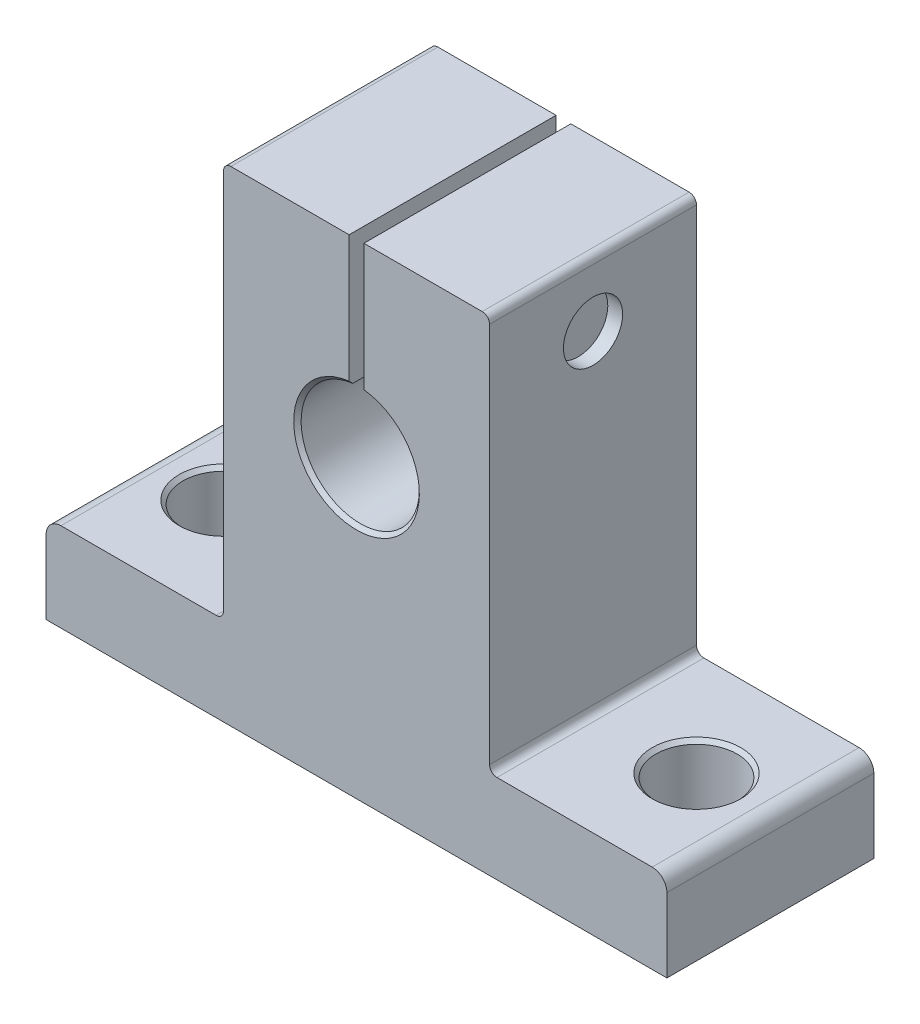
from build123d import *

# Parameters (mm, degrees)
BOSS_EXTRUDE1_DEPTH     = 14
CUT_EXTRUDE1_DEPTH      = 42.386471219
CUT_EXTRUDE1_DEPTH_BACK = 6
SKETCH3_R               = 2.75
FILLET1_R               = 1
FILLET2_R               = 0.5
CHAMFER1_SIZE           = 0.25
SKETCH4_R               = 3.1
CUT_EXTRUDE2_DEPTH      = 1
SKETCH5_R               = 3.1
SKETCH5_R_2             = 3
CUT_EXTRUDE3_DEPTH      = 4
CHAMFER2_SIZE           = 0.2
CUT_EXTRUDE4_DEPTH      = 2
SKETCH7_R               = 2
BOSS_EXTRUDE2_DEPTH     = 1
CUT_EXTRUDE5_START      = -1
SKETCH8_R               = 2
CUT_EXTRUDE5_DEPTH      = 1
SKETCH9_R               = 1.732050808
CUT_EXTRUDE6_DEPTH      = 1
CUT_EXTRUDE6_DRAFT      = -45


with BuildPart() as part:
    # Sketch1 → Boss-Extrude1 (new body)
    with BuildSketch(Plane.XY):
        with BuildLine():
            Line((-21, 0), (21, 0))
            Line((21, 0), (21, 6))
            Line((21, 6), (9, 6))
            Line((9, 6), (9, 32.8))
            Line((9, 32.8), (0.5, 32.8))
            Line((0.5, 32.8), (0.5, 23.968626967))
            ThreePointArc((0.5, 23.968626967), (0, 16), (-0.5, 23.968626967))
            Line((-0.5, 23.968626967), (-0.5, 32.8))
            Line((-0.5, 32.8), (-9, 32.8))
            Line((-9, 32.8), (-9, 6))
            Line((-9, 6), (-21, 6))
            Line((-21, 6), (-21, 0))
        make_face()
    extrude(amount=BOSS_EXTRUDE1_DEPTH)

    # Sketch3 → Cut-Extrude1 (cut, two sides: drawn at the far end of the back side and taken through both)
    with BuildSketch(Plane.XZ.offset(-CUT_EXTRUDE1_DEPTH_BACK)):
        with Locations(Location((-16, 7, 0), (0, 0, 180))):
            Circle(SKETCH3_R)
        with Locations(Location((16, 7, 0), (0, 0, 180))):
            Circle(SKETCH3_R)
    extrude(amount=CUT_EXTRUDE1_DEPTH + CUT_EXTRUDE1_DEPTH_BACK, mode=Mode.SUBTRACT)

    # Fillet1
    fillet1_edges = [part.edges().sort_by_distance(p)[0] for p in [
        (-21, 6, 7),
        (21, 6, 7),
    ]]
    fillet(fillet1_edges, radius=FILLET1_R)

    # Fillet2
    fillet2_edges = [part.edges().sort_by_distance(p)[0] for p in [
        (-9, 6, 7),
        (-9, 32.8, 7),
        (9, 32.8, 7),
        (9, 6, 7),
    ]]
    fillet(fillet2_edges, radius=FILLET2_R)

    # Chamfer1
    chamfer1_edges = [part.edges().sort_by_distance(p)[0] for p in [
        (0, 16, 0),
        (0, 16, 14),
        (18.75, 6, 7),
        (18.75, 0, 7),
        (-13.25, 6, 7),
        (-13.25, 0, 7),
    ]]
    chamfer(chamfer1_edges, length=CHAMFER1_SIZE)

    # Sketch4 → Cut-Extrude2 (cut)
    with BuildSketch(Plane.ZY.offset(9)):
        with Locations(Location((7, 28.4, 0), (0, 0, 270))):
            Circle(SKETCH4_R)
    extrude(amount=-CUT_EXTRUDE2_DEPTH, mode=Mode.SUBTRACT)

    # Sketch5 → Cut-Extrude3 (cut)
    with BuildSketch(Plane.ZY.offset(8)):
        with Locations(Location((7, 28.4, 0), (0, 0, 270))):
            Circle(SKETCH5_R)
        with Locations(Location((7, 28.4, 0), (0, 0, 270))):
            Circle(SKETCH5_R_2, mode=Mode.SUBTRACT)
    extrude(amount=-CUT_EXTRUDE3_DEPTH, mode=Mode.SUBTRACT)

    # Chamfer2
    chamfer2_edges = [part.edges().sort_by_distance(p)[0] for p in [
        (-8, 31.4, 7),
    ]]
    chamfer(chamfer2_edges, length=CHAMFER2_SIZE)

    # Sketch6 → Cut-Extrude4 (cut)
    with BuildSketch(Plane.ZY.offset(8)):
        Polygon((7.16076668, 30.124573592), (5.586858798, 29.401514825), (5.426092119, 27.676941233), (6.83923332, 26.675426408), (8.413141202, 27.398485175), (8.573907881, 29.123058767), align=None)
    extrude(amount=-CUT_EXTRUDE4_DEPTH, mode=Mode.SUBTRACT)

    # Sketch7 → Boss-Extrude2 (add)
    with BuildSketch(Plane(origin=(-0.5, 0, 0), x_dir=(0, 0, -1), z_dir=(1, 0, 0))):
        with Locations(Location((-7, 28.4, 0), (0, 0, 270))):
            Circle(SKETCH7_R)
    extrude(amount=BOSS_EXTRUDE2_DEPTH)

    # Sketch8 → Cut-Extrude5 (cut)
    with BuildSketch(Plane(origin=(9, 0, 0), x_dir=(0, 0, -1), z_dir=(1, 0, 0)).offset(CUT_EXTRUDE5_START)):
        with Locations(Location((-7, 28.4, 0), (0, 0, 270))):
            Circle(SKETCH8_R)
    extrude(amount=CUT_EXTRUDE5_DEPTH, mode=Mode.SUBTRACT)


with BuildPart() as cut_extrude6_tool:
    # Sketch9 → Cut-Extrude6 (with draft: the straight prism first)
    with BuildSketch(Plane.ZY.offset(8)):
        with Locations((7, 28.4)):
            Circle(SKETCH9_R)
    extrude(amount=-CUT_EXTRUDE6_DEPTH)
    # Cut-Extrude6: the draft: its side faces are tilted about the plane it starts from
    cut_extrude6_sides = [cut_extrude6_tool.faces().sort_by_distance(p)[0] for p in [
        (-7.5, 28.4, 5.267949192),
    ]]
    draft(cut_extrude6_sides, Plane.ZY.offset(8), CUT_EXTRUDE6_DRAFT)


with BuildPart() as part_1:
    add(part.part)

    # Cut-Extrude6: cut by cut_extrude6_tool
    add(cut_extrude6_tool.part, mode=Mode.SUBTRACT)


solid = part_1.part
